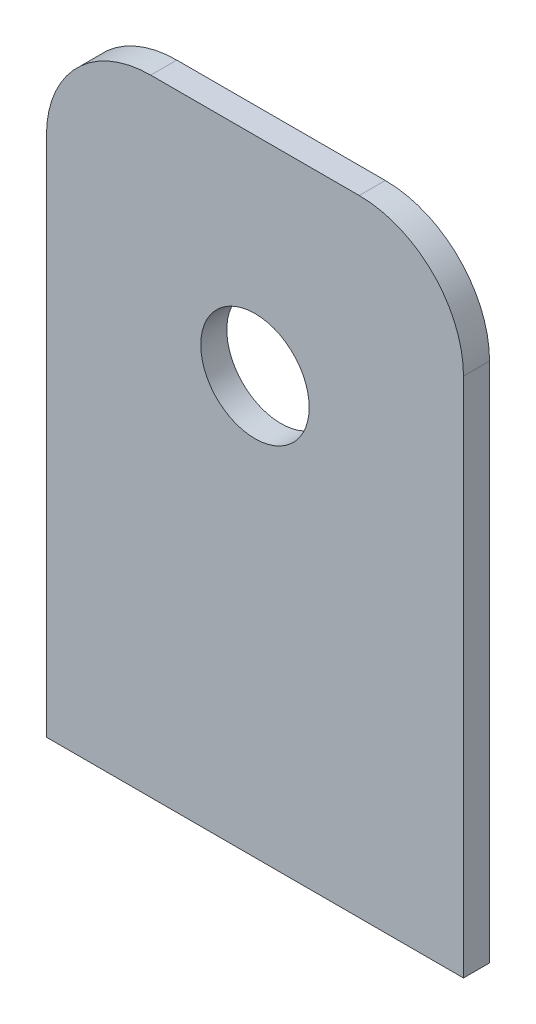
from build123d import *

# Parameters (mm, degrees)
SKETCH1_W               = 25.4
SKETCH1_H               = 38.1
BOSS_EXTRUDE1_DEPTH     = 1.5875
CUT_EXTRUDE1_DEPTH      = 41.192289761
CUT_EXTRUDE1_DEPTH_BACK = 41.192289761
SKETCH2_R               = 3.302
FILLET1_R               = 6.35


with BuildPart() as part:
    # Sketch1 → Boss-Extrude1 (new body)
    with BuildSketch(Plane.XY):
        with Locations((0, 19.05)):
            Rectangle(SKETCH1_W, SKETCH1_H)
    extrude(amount=BOSS_EXTRUDE1_DEPTH)

    # Sketch2 → Cut-Extrude1 (cut, two sides: drawn at the far end of the back side and taken through both)
    with BuildSketch(Plane.XY.offset(1.5875).offset(-CUT_EXTRUDE1_DEPTH_BACK)):
        with Locations((0, 25.4)):
            Circle(SKETCH2_R)
    extrude(amount=CUT_EXTRUDE1_DEPTH + CUT_EXTRUDE1_DEPTH_BACK, mode=Mode.SUBTRACT)

    # Fillet1
    fillet1_edges = [part.edges().sort_by_distance(p)[0] for p in [
        (-12.7, 38.1, 0.79375),
        (12.7, 38.1, 0.79375),
    ]]
    fillet(fillet1_edges, radius=FILLET1_R)


solid = part.part
